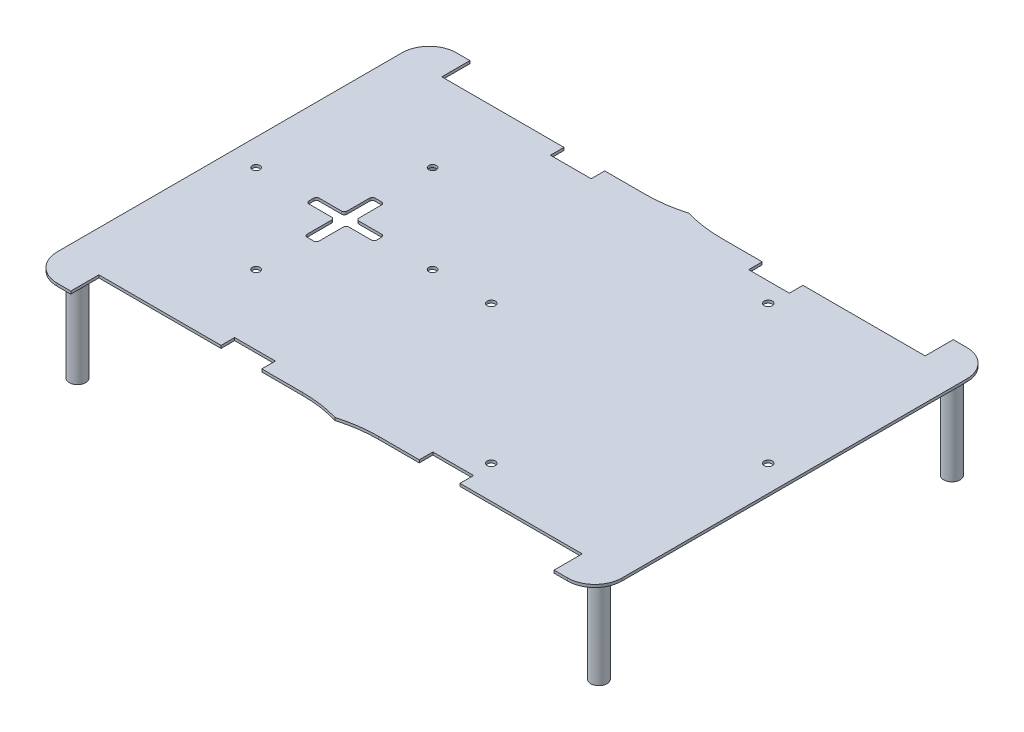
from build123d import *

# Parameters (mm, degrees)
SKETCH1_W            = 208
SKETCH1_H            = 147
BOSS_EXTRUDE1_DEPTH  = 1
CUT_EXTRUDE1_DEPTH   = 128.354819304
MIRROR2_COPY_1_DEPTH = 128.354819304
FILLET1_R            = 10
CUT_EXTRUDE2_DEPTH   = 128.354819304
SKETCH7_R            = 1.5
CUT_EXTRUDE3_DEPTH   = 128.354819304
SKETCH8_R            = 3
BOSS_EXTRUDE3_DEPTH  = 35
SKETCH9_R            = 1.4
CUT_EXTRUDE4_DEPTH   = 60


with BuildPart() as part:
    # Sketch1 → Boss-Extrude1 (new body)
    with BuildSketch(Plane(origin=(0, 0, 0), x_dir=(1, 0, 0), z_dir=(0, 1, 0))):
        Rectangle(SKETCH1_W, SKETCH1_H)
    extrude(amount=BOSS_EXTRUDE1_DEPTH)

    # Sketch3 → Cut-Extrude1 (cut, through all)
    with BuildSketch(Plane(origin=(0, 1, 0), x_dir=(1, 0, 0), z_dir=(0, 1, 0))):
        with BuildLine():
            Line((-89, 83.145473262), (-89, 63.145473262))
            Line((-89, 63.145473262), (-44, 63.145473262))
            Line((-44, 63.145473262), (-44, 58.145473262))
            Line((-44, 58.145473262), (-29, 58.145473262))
            Line((-29, 58.145473262), (-29, 63.145473262))
            Line((-29, 63.145473262), (-14, 63.145473262))
            ThreePointArc((-14, 63.145473262), (-6.928932188, 63.647998579), (0, 65.145473262))
            Line((0, 65.145473262), (0, 85.145473262))
            Line((0, 85.145473262), (-89, 85.145473262))
            Line((-89, 85.145473262), (-89, 83.145473262))
        make_face()
    cut_extrude1 = extrude(amount=-CUT_EXTRUDE1_DEPTH, mode=Mode.SUBTRACT)

    # Mirror1: Cut-Extrude1 across plane
    add(cut_extrude1.mirror(Plane.XY), mode=Mode.SUBTRACT)

    # Mirror2: Cut-Extrude1 across plane
    add(cut_extrude1.mirror(Plane(origin=(0, 0, 0), x_dir=(0, 0, 1), z_dir=(1, 0, 0))), mode=Mode.SUBTRACT)

    # Mirror2 copy 1 sketch → Mirror2 copy 1 (cut, through all)
    with BuildSketch(Plane(origin=(0, 1, 0), x_dir=(-1, 0, 0), z_dir=(0, 1, 0))):
        with BuildLine():
            Line((-89, 83.145473262), (-89, 63.145473262))
            Line((-89, 63.145473262), (-44, 63.145473262))
            Line((-44, 63.145473262), (-44, 58.145473262))
            Line((-44, 58.145473262), (-29, 58.145473262))
            Line((-29, 58.145473262), (-29, 63.145473262))
            Line((-29, 63.145473262), (-14, 63.145473262))
            ThreePointArc((-14, 63.145473262), (-6.928932188, 63.647998579), (0, 65.145473262))
            Line((0, 65.145473262), (0, 85.145473262))
            Line((0, 85.145473262), (-89, 85.145473262))
            Line((-89, 85.145473262), (-89, 83.145473262))
        make_face()
    extrude(amount=-MIRROR2_COPY_1_DEPTH, mode=Mode.SUBTRACT)

    # Fillet1
    fillet1_edges = [part.edges().sort_by_distance(p)[0] for p in [
        (104, 0.5, 73.5),
        (-104, 0.5, 73.5),
        (-104, 0.5, -73.5),
        (104, 0.5, -73.5),
    ]]
    fillet(fillet1_edges, radius=FILLET1_R)

    # Sketch4 → Cut-Extrude2 (cut, through all)
    with BuildSketch(Plane.XZ):
        with BuildLine():
            Line((-58.225796132, 1.876244538), (-49.924870206, 1.876244538))
            ThreePointArc((-49.924870206, 1.876244538), (-49.217763425, 1.583351319), (-48.924870206, 0.876244538))
            Line((-48.924870206, 0.876244538), (-48.924870206, -0.876244538))
            ThreePointArc((-48.924870206, -0.876244538), (-49.217763425, -1.583351319), (-49.924870206, -1.876244538))
            Line((-49.924870206, -1.876244538), (-58.225796132, -1.876244538))
            ThreePointArc((-58.225796132, -1.876244538), (-58.932902913, -2.169137757), (-59.225796132, -2.876244538))
            Line((-59.225796132, -2.876244538), (-59.225796132, -11.176244538))
            ThreePointArc((-59.225796132, -11.176244538), (-59.518689351, -11.883351319), (-60.225796132, -12.176244538))
            Line((-60.225796132, -12.176244538), (-62.62394428, -12.176244538))
            ThreePointArc((-62.62394428, -12.176244538), (-63.331051061, -11.883351319), (-63.62394428, -11.176244538))
            Line((-63.62394428, -11.176244538), (-63.62394428, -2.876244538))
            ThreePointArc((-63.62394428, -2.876244538), (-63.916837499, -2.169137757), (-64.62394428, -1.876244538))
            Line((-64.62394428, -1.876244538), (-72.924870206, -1.876244538))
            ThreePointArc((-72.924870206, -1.876244538), (-73.631976987, -1.583351319), (-73.924870206, -0.876244538))
            Line((-73.924870206, -0.876244538), (-73.924870206, 0.876244538))
            ThreePointArc((-73.924870206, 0.876244538), (-73.631976987, 1.583351319), (-72.924870206, 1.876244538))
            Line((-72.924870206, 1.876244538), (-64.62394428, 1.876244538))
            ThreePointArc((-64.62394428, 1.876244538), (-63.916837499, 2.169137757), (-63.62394428, 2.876244538))
            Line((-63.62394428, 2.876244538), (-63.62394428, 11.823755462))
            ThreePointArc((-63.62394428, 11.823755462), (-63.331051061, 12.530862243), (-62.62394428, 12.823755462))
            Line((-62.62394428, 12.823755462), (-60.225796132, 12.823755462))
            ThreePointArc((-60.225796132, 12.823755462), (-59.518689351, 12.530862243), (-59.225796132, 11.823755462))
            Line((-59.225796132, 11.823755462), (-59.225796132, 2.876244538))
            ThreePointArc((-59.225796132, 2.876244538), (-58.932902913, 2.169137757), (-58.225796132, 1.876244538))
        make_face()
    extrude(amount=-CUT_EXTRUDE2_DEPTH, mode=Mode.SUBTRACT)

    # Sketch7 → Cut-Extrude3 (cut, through all)
    with BuildSketch(Plane.XZ):
        with Locations(Location((43.368968207, 51, 0), (0, 0, 270))):
            Circle(SKETCH7_R)
        with Locations(Location((-7.631031793, 0, 0), (0, 0, 270))):
            Circle(SKETCH7_R)
        with Locations(Location((94.368968207, 0, 0), (0, 0, 270))):
            Circle(SKETCH7_R)
        with Locations(Location((43.368968207, -51, 0), (0, 0, 270))):
            Circle(SKETCH7_R)
    extrude(amount=-CUT_EXTRUDE3_DEPTH, mode=Mode.SUBTRACT)

    # Sketch8 → Boss-Extrude3 (add)
    with BuildSketch(Plane(origin=(0, 1, 0), x_dir=(1, 0, 0), z_dir=(0, 1, 0))):
        with Locations(Location((-95, 65, 0), (0, 0, 270))):
            Circle(SKETCH8_R)
        with Locations(Location((-95, -65, 0), (0, 0, 270))):
            Circle(SKETCH8_R)
        with Locations(Location((97, -65, 0), (0, 0, 270))):
            Circle(SKETCH8_R)
        with Locations(Location((97, 65, 0), (0, 0, 270))):
            Circle(SKETCH8_R)
    extrude(amount=-BOSS_EXTRUDE3_DEPTH)

    # Sketch9 → Cut-Extrude4 (cut)
    with BuildSketch(Plane(origin=(0, 1, 0), x_dir=(1, 0, 0), z_dir=(0, 1, 0))):
        with Locations(Location((-61.740102401, 32.5, 0), (0, 0, 270))):
            Circle(SKETCH9_R)
        with Locations(Location((-94.240102401, 0, 0), (0, 0, 270))):
            Circle(SKETCH9_R)
        with Locations(Location((-61.740102401, -32.5, 0), (0, 0, 270))):
            Circle(SKETCH9_R)
        with Locations(Location((-29.240102401, 0, 0), (0, 0, 270))):
            Circle(SKETCH9_R)
    extrude(amount=-CUT_EXTRUDE4_DEPTH, mode=Mode.SUBTRACT)


solid = part.part
